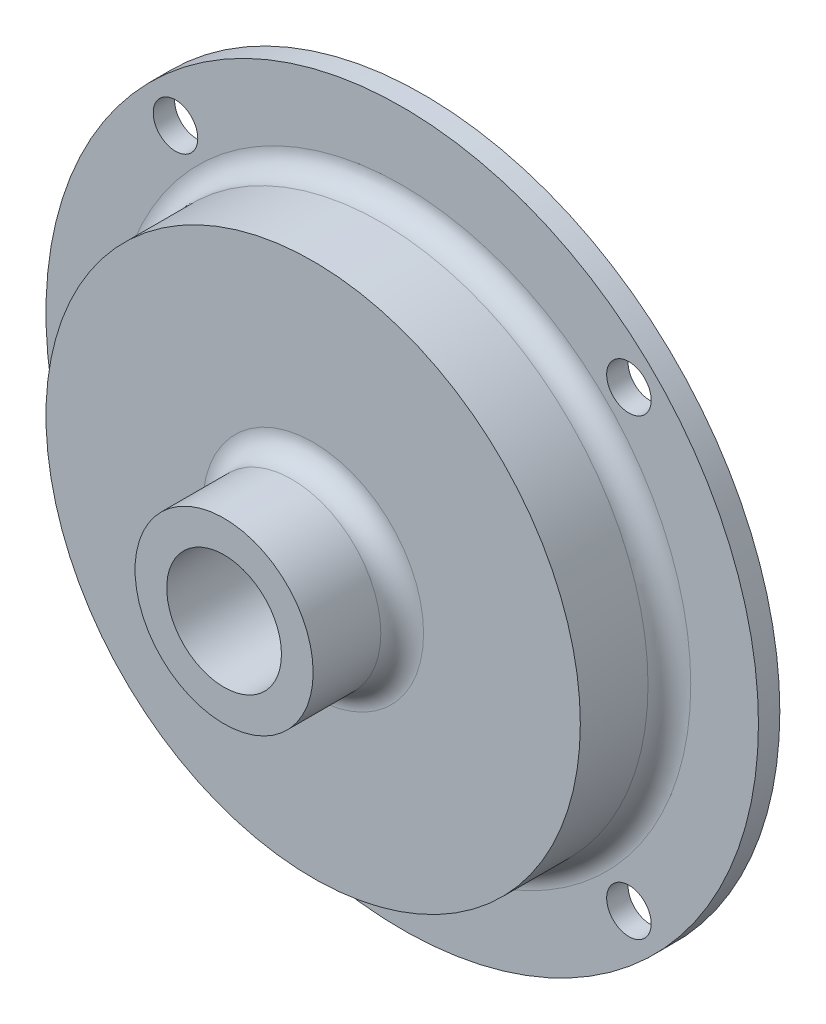
from build123d import *

# Parameters (mm, degrees)
SKETCH1_R           = 50
SKETCH1_R_2         = 3.125
BASE_EXTRUDE_DEPTH  = 3
SKETCH2_R           = 37.5
BOSS_EXTRUDE1_DEPTH = 12.5
SKETCH3_R           = 12.5
BOSS_EXTRUDE2_DEPTH = 12.5
FILLET1_R           = 3
SKETCH4_R           = 8.05
CUT_EXTRUDE1_DEPTH  = 77.052613367


with BuildPart() as part:
    # Sketch1 → Base-Extrude (new body)
    with BuildSketch(Plane.XY):
        Circle(SKETCH1_R)
        with Locations((31.819805153, 31.819805153)):
            Circle(SKETCH1_R_2, mode=Mode.SUBTRACT)
        with Locations((-31.819805153, -31.819805153)):
            Circle(SKETCH1_R_2, mode=Mode.SUBTRACT)
        with Locations((31.819805153, -31.819805153)):
            Circle(SKETCH1_R_2, mode=Mode.SUBTRACT)
        with Locations((-31.819805153, 31.819805153)):
            Circle(SKETCH1_R_2, mode=Mode.SUBTRACT)
    extrude(amount=BASE_EXTRUDE_DEPTH)

    # Sketch2 → Boss-Extrude1 (add)
    with BuildSketch(Plane.XY.offset(3)):
        Circle(SKETCH2_R)
    extrude(amount=BOSS_EXTRUDE1_DEPTH)

    # Sketch3 → Boss-Extrude2 (add)
    with BuildSketch(Plane.XY.offset(15.5)):
        Circle(SKETCH3_R)
    extrude(amount=BOSS_EXTRUDE2_DEPTH)

    # Fillet1
    fillet1_edges = [part.edges().sort_by_distance(p)[0] for p in [
        (-37.5, 0, 3),
        (-12.5, 0, 15.5),
    ]]
    fillet(fillet1_edges, radius=FILLET1_R)

    # Sketch4 → Cut-Extrude1 (cut, through all)
    with BuildSketch(Plane.XY.offset(28)):
        Circle(SKETCH4_R)
    extrude(amount=-CUT_EXTRUDE1_DEPTH, mode=Mode.SUBTRACT)


solid = part.part
